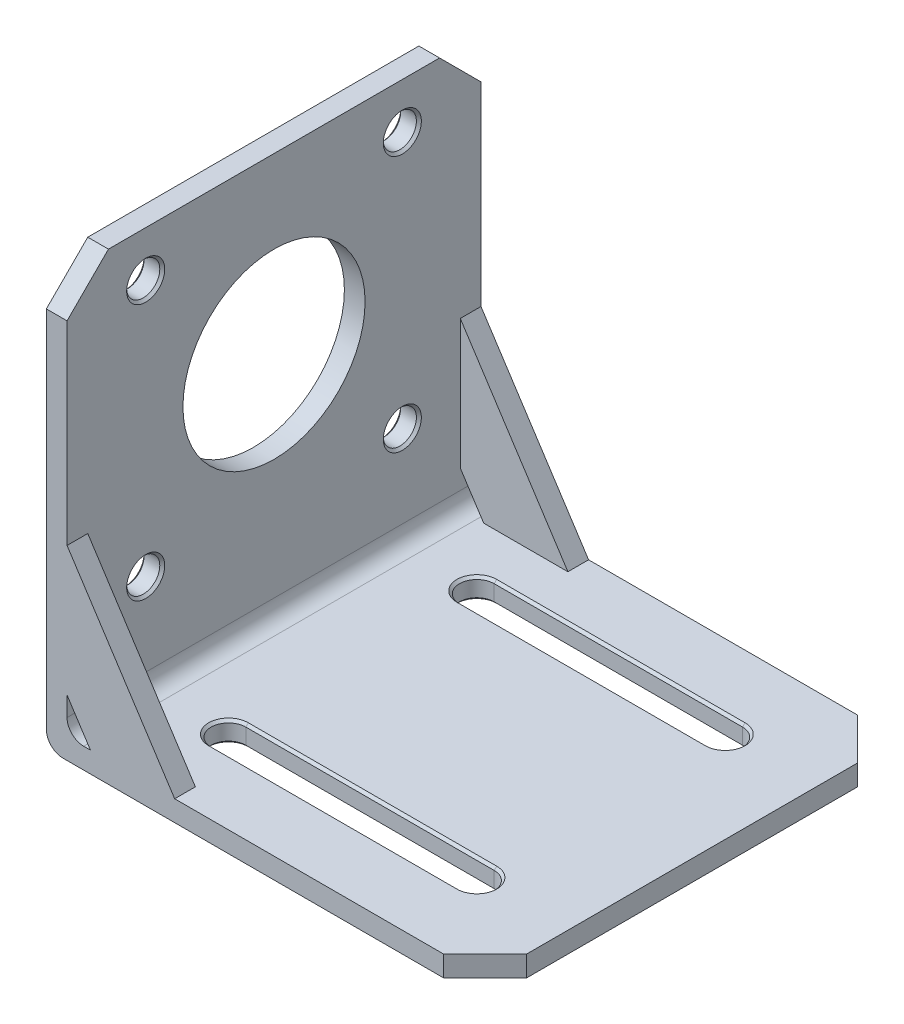
from build123d import *

# Parameters (mm, degrees)
SKETCH1_W           = 53
SKETCH1_H           = 50
BOSS_EXTRUDE1_DEPTH = 2.5
SKETCH2_W           = 50
SKETCH2_H           = 51
BOSS_EXTRUDE2_DEPTH = 2.5
CHAMFER1_SIZE       = 5
SKETCH3_R           = 11
SKETCH3_R_2         = 2
CUT_EXTRUDE1_DEPTH  = 2.5
CUT_EXTRUDE2_DEPTH  = 2.5
FILLET1_R           = 2
FILLET2_R           = 2
CHAMFER2_SIZE       = 0.3
CHAMFER3_SIZE       = 0.3
BOSS_EXTRUDE3_DEPTH = 2.5
BOSS_EXTRUDE4_DEPTH = 2.5


with BuildPart() as part:
    # Sketch1 → Boss-Extrude1 (new body)
    with BuildSketch(Plane(origin=(0, 0, 0), x_dir=(1, 0, 0), z_dir=(0, 1, 0))):
        Rectangle(SKETCH1_W, SKETCH1_H)
    extrude(amount=BOSS_EXTRUDE1_DEPTH)

    # Sketch2 → Boss-Extrude2 (add)
    with BuildSketch(Plane.ZY.offset(26.5)):
        with Locations((0, 25.5)):
            Rectangle(SKETCH2_W, SKETCH2_H)
    extrude(amount=-BOSS_EXTRUDE2_DEPTH)

    # Chamfer1
    chamfer1_edges = [part.edges().sort_by_distance(p)[0] for p in [
        (-25.25, 51, 25),
        (-25.25, 51, -25),
        (26.5, 1.25, 25),
        (26.5, 1.25, -25),
    ]]
    chamfer(chamfer1_edges, length=CHAMFER1_SIZE)

    # Sketch3 → Cut-Extrude1 (cut)
    with BuildSketch(Plane.ZY.offset(26.5)):
        with Locations((0, 30)):
            Circle(SKETCH3_R)
        with Locations((-15.5, 45.5)):
            Circle(SKETCH3_R_2)
        with Locations((15.5, 45.5)):
            Circle(SKETCH3_R_2)
        with Locations((-15.5, 14.5)):
            Circle(SKETCH3_R_2)
        with Locations((15.5, 14.5)):
            Circle(SKETCH3_R_2)
    extrude(amount=-CUT_EXTRUDE1_DEPTH, mode=Mode.SUBTRACT)

    # Sketch4 → Cut-Extrude2 (cut)
    with BuildSketch(Plane(origin=(0, 2.5, 0), x_dir=(1, 0, 0), z_dir=(0, 1, 0))):
        with BuildLine():
            Line((-14.5, 17.1), (15.5, 17.1))
            ThreePointArc((15.5, 17.1), (17.6, 15), (15.5, 12.9))
            Line((15.5, 12.9), (-14.5, 12.9))
            ThreePointArc((-14.5, 12.9), (-16.6, 15), (-14.5, 17.1))
        make_face()
        with BuildLine():
            Line((-14.5, -12.9), (15.5, -12.9))
            ThreePointArc((15.5, -12.9), (17.6, -15), (15.5, -17.1))
            Line((15.5, -17.1), (-14.5, -17.1))
            ThreePointArc((-14.5, -17.1), (-16.6, -15), (-14.5, -12.9))
        make_face()
    extrude(amount=-CUT_EXTRUDE2_DEPTH, mode=Mode.SUBTRACT)

    # Fillet1
    fillet1_edges = [part.edges().sort_by_distance(p)[0] for p in [
        (-24, 2.5, 0),
    ]]
    fillet(fillet1_edges, radius=FILLET1_R)

    # Fillet2
    fillet2_edges = [part.edges().sort_by_distance(p)[0] for p in [
        (-26.5, 0, 0),
    ]]
    fillet(fillet2_edges, radius=FILLET2_R)

    # Chamfer2
    chamfer2_edges = [part.edges().sort_by_distance(p)[0] for p in [
        (-24, 45.5, -17.5),
        (-26.5, 45.5, -17.5),
        (-24, 45.5, 13.5),
        (-26.5, 45.5, 13.5),
        (-24, 14.5, -17.5),
        (-26.5, 14.5, -17.5),
        (-24, 14.5, 13.5),
        (-26.5, 14.5, 13.5),
    ]]
    chamfer(chamfer2_edges, length=CHAMFER2_SIZE)

    # Chamfer3
    chamfer3_edges = [part.edges().sort_by_distance(p)[0] for p in [
        (-16.6, 0, 15),
        (0.5, 2.5, 12.9),
        (17.6, 0, 15),
        (0.5, 0, 17.1),
        (0.5, 0, 12.9),
        (-16.6, 2.5, 15),
        (0.5, 2.5, 17.1),
        (17.6, 2.5, 15),
        (-16.6, 0, -15),
        (0.5, 2.5, -17.1),
        (17.6, 0, -15),
        (0.5, 0, -12.9),
        (0.5, 0, -17.1),
        (-16.6, 2.5, -15),
        (0.5, 2.5, -12.9),
        (17.6, 2.5, -15),
    ]]
    chamfer(chamfer3_edges, length=CHAMFER3_SIZE)

    # Sketch5 → Boss-Extrude3 (add)
    with BuildSketch(Plane.XY.offset(25)):
        Polygon((-24, 22.5), (-11, 2.5), (-21.171930363, 2.5), (-24, 6.850876365), align=None)
    extrude(amount=-BOSS_EXTRUDE3_DEPTH)

    # Sketch6 → Boss-Extrude4 (add)
    with BuildSketch(Plane(origin=(0, 0, -25), x_dir=(-1, 0, 0), z_dir=(0, 0, -1))):
        Polygon((24, 22.5), (11, 2.5), (21.171930363, 2.5), (24, 6.850876365), align=None)
    extrude(amount=-BOSS_EXTRUDE4_DEPTH)


solid = part.part
